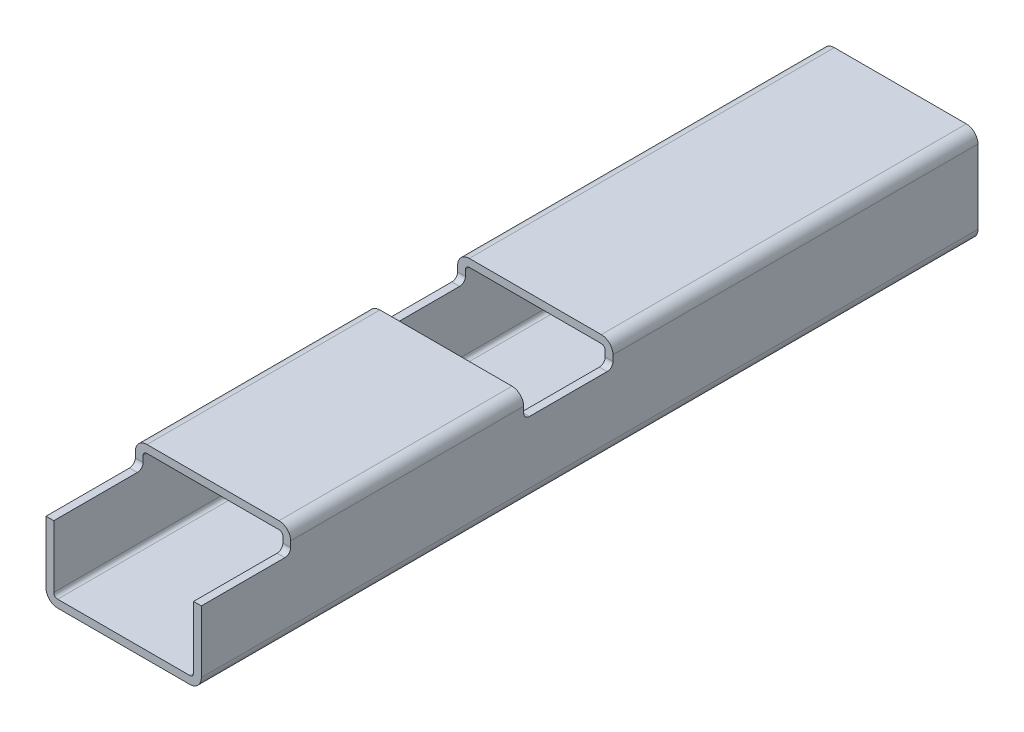
from build123d import *

# Parameters (mm, degrees)
EXTRUDE_1_DEPTH     = 400
CUT_EXTRUDE_1_DEPTH = 409.686921738


with BuildPart() as part:
    # Эскиз1 → Бобышка-Вытянуть1 (new body)
    with BuildSketch(Plane.XY):
        with BuildLine():
            Line((-34, -25), (34, -25))
            ThreePointArc((34, -25), (38.242640687, -23.242640687), (40, -19))
            Line((40, -19), (40, 19))
            ThreePointArc((40, 19), (38.242640687, 23.242640687), (34, 25))
            Line((34, 25), (-34, 25))
            ThreePointArc((-34, 25), (-38.242640687, 23.242640687), (-40, 19))
            Line((-40, 19), (-40, -19))
            ThreePointArc((-40, -19), (-38.242640687, -23.242640687), (-34, -25))
        make_face()
        with BuildLine():
            Line((-34, -21), (34, -21))
            ThreePointArc((34, -21), (35.414213562, -20.414213562), (36, -19))
            Line((36, -19), (36, 19))
            ThreePointArc((36, 19), (35.414213562, 20.414213562), (34, 21))
            Line((34, 21), (-34, 21))
            ThreePointArc((-34, 21), (-35.414213562, 20.414213562), (-36, 19))
            Line((-36, 19), (-36, -19))
            ThreePointArc((-36, -19), (-35.414213562, -20.414213562), (-34, -21))
        make_face(mode=Mode.SUBTRACT)
    extrude(amount=EXTRUDE_1_DEPTH)

    # Эскиз2 → Вырез-Вытянуть1 (cut, through all)
    with BuildSketch(Plane(origin=(40, 0, 0), x_dir=(0, 0, -1), z_dir=(1, 0, 0))):
        with BuildLine():
            Line((-400, 13), (-357, 13))
            ThreePointArc((-357, 13), (-354.878679656, 13.878679656), (-354, 16))
            Line((-354, 16), (-354, 25))
            Line((-354, 25), (-400, 25))
            Line((-400, 25), (-400, 13))
        make_face()
        with BuildLine():
            Line((-231, 13), (-191, 13))
            ThreePointArc((-191, 13), (-188.878679656, 13.878679656), (-188, 16))
            Line((-188, 16), (-188, 25))
            Line((-188, 25), (-234, 25))
            Line((-234, 25), (-234, 16))
            ThreePointArc((-234, 16), (-233.121320344, 13.878679656), (-231, 13))
        make_face()
    extrude(amount=-CUT_EXTRUDE_1_DEPTH, mode=Mode.SUBTRACT)


solid = part.part
